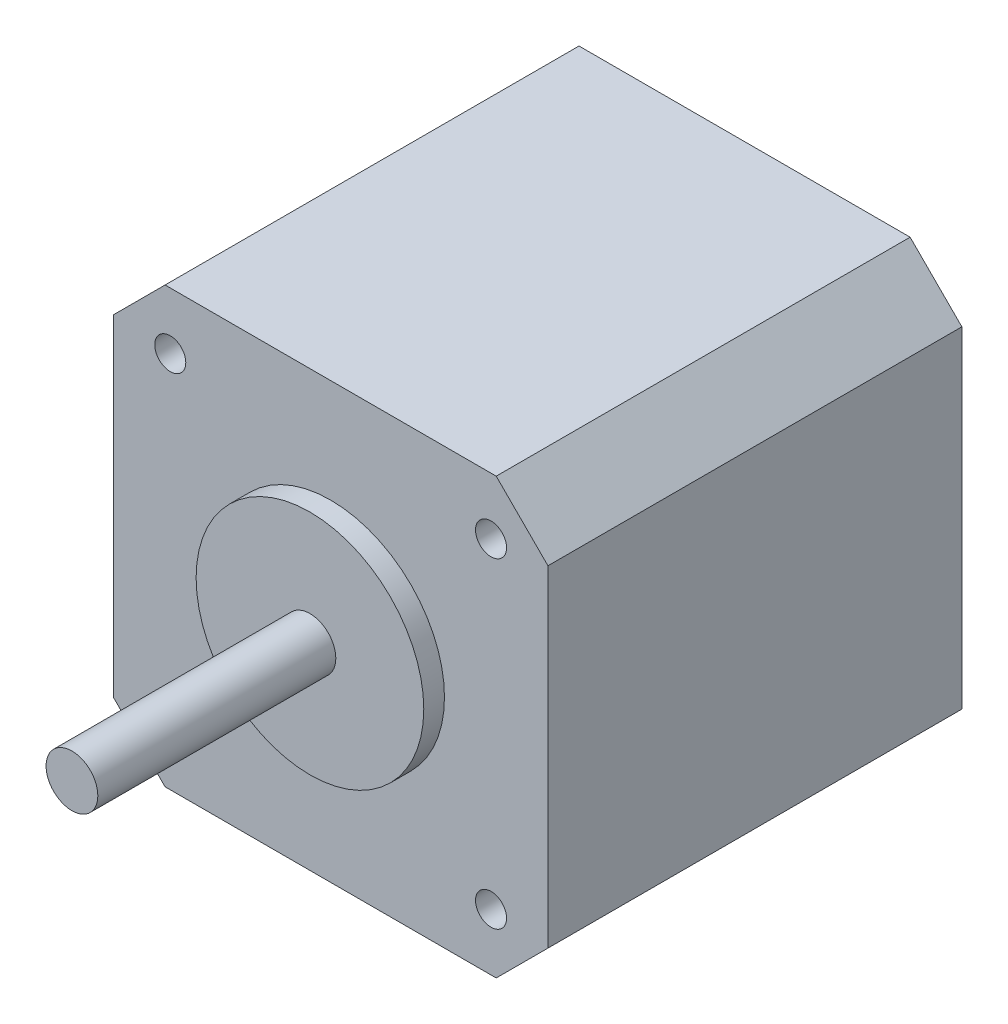
from build123d import *

# Parameters (mm, degrees)
SKETCH_1_W          = 42
SKETCH_1_H          = 42
EXTRUDE_1_DEPTH     = 40
CHAMFER_1_SIZE      = 5
SKETCH_2_R          = 11
EXTRUDE_2_DEPTH     = 2
SKETCH_3_R          = 2.5
EXTRUDE_3_DEPTH     = 23
SKETCH_4_R          = 1.5
CUT_EXTRUDE_1_DEPTH = 3


with BuildPart() as part:
    # 草圖1 → 填料-伸長1 (new body)
    with BuildSketch(Plane.XY):
        Rectangle(SKETCH_1_W, SKETCH_1_H)
    extrude(amount=EXTRUDE_1_DEPTH)

    # 導角1
    chamfer_1_edges = [part.edges().sort_by_distance(p)[0] for p in [
        (-21, 21, 20),
        (21, 21, 20),
        (21, -21, 20),
        (-21, -21, 20),
    ]]
    chamfer(chamfer_1_edges, length=CHAMFER_1_SIZE)

    # 草圖2 → 填料-伸長2 (add)
    with BuildSketch(Plane.XY.offset(40)):
        Circle(SKETCH_2_R)
    extrude(amount=EXTRUDE_2_DEPTH)

    # 草圖3 → 填料-伸長3 (add)
    with BuildSketch(Plane.XY.offset(42)):
        Circle(SKETCH_3_R)
    extrude(amount=EXTRUDE_3_DEPTH)

    # 草圖4 → 除料-伸長1 (cut)
    with BuildSketch(Plane.XY.offset(40)):
        with Locations((-15.5, 15.5)):
            Circle(SKETCH_4_R)
        with Locations(Location((-15.5, -15.5, 0), (0, 0, 180))):
            Circle(SKETCH_4_R)
        with Locations((15.5, -15.5)):
            Circle(SKETCH_4_R)
        with Locations(Location((15.5, 15.5, 0), (0, 0, 180))):
            Circle(SKETCH_4_R)
    extrude(amount=-CUT_EXTRUDE_1_DEPTH, mode=Mode.SUBTRACT)


solid = part.part
